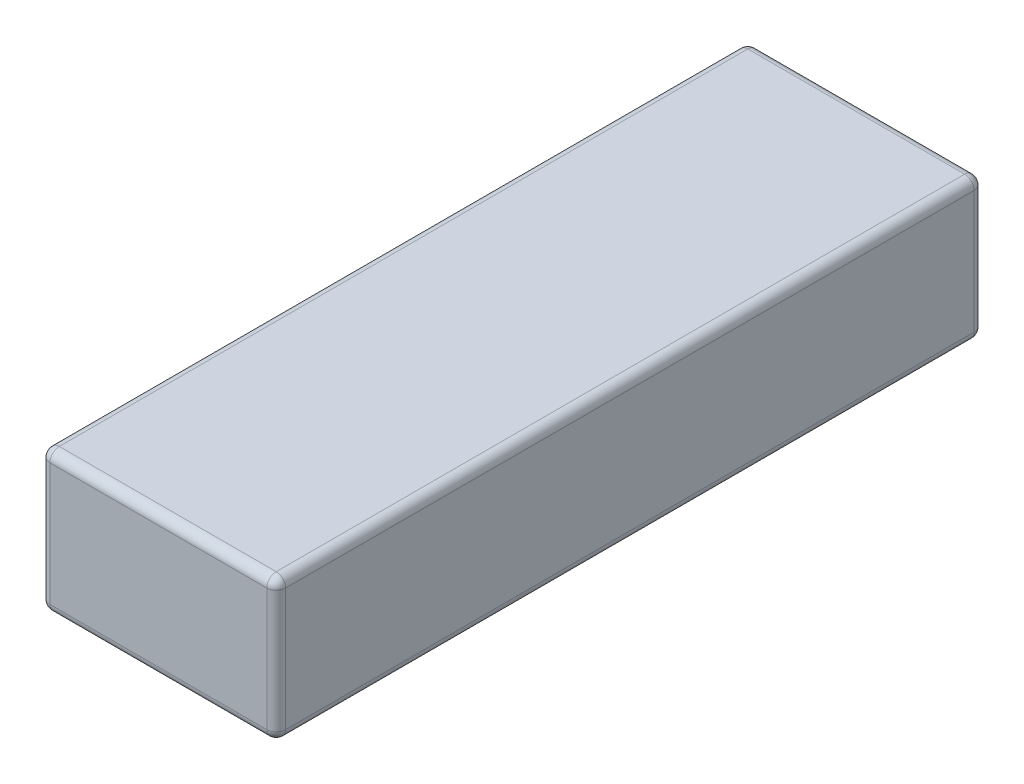
from build123d import *

# Parameters (mm, degrees)
SKETCH2_W           = 50
SKETCH2_H           = 150
BOSS_EXTRUDE1_DEPTH = 30
FILLET1_R           = 2


with BuildPart() as part:
    # Sketch2 → Boss-Extrude1 (new body)
    with BuildSketch(Plane(origin=(0, 0, 0), x_dir=(1, 0, 0), z_dir=(0, 1, 0))):
        Rectangle(SKETCH2_W, SKETCH2_H)
    extrude(amount=BOSS_EXTRUDE1_DEPTH)

    # Fillet1
    fillet1_edges = [part.edges().sort_by_distance(p)[0] for p in [
        (-25, 30, 0),
        (0, 30, 75),
        (25, 30, 0),
        (0, 0, 75),
        (-25, 0, 0),
        (0, 0, -75),
        (25, 0, 0),
        (25, 15, 75),
        (-25, 15, 75),
        (-25, 15, -75),
        (25, 15, -75),
        (0, 30, -75),
    ]]
    fillet(fillet1_edges, radius=FILLET1_R)


solid = part.part
